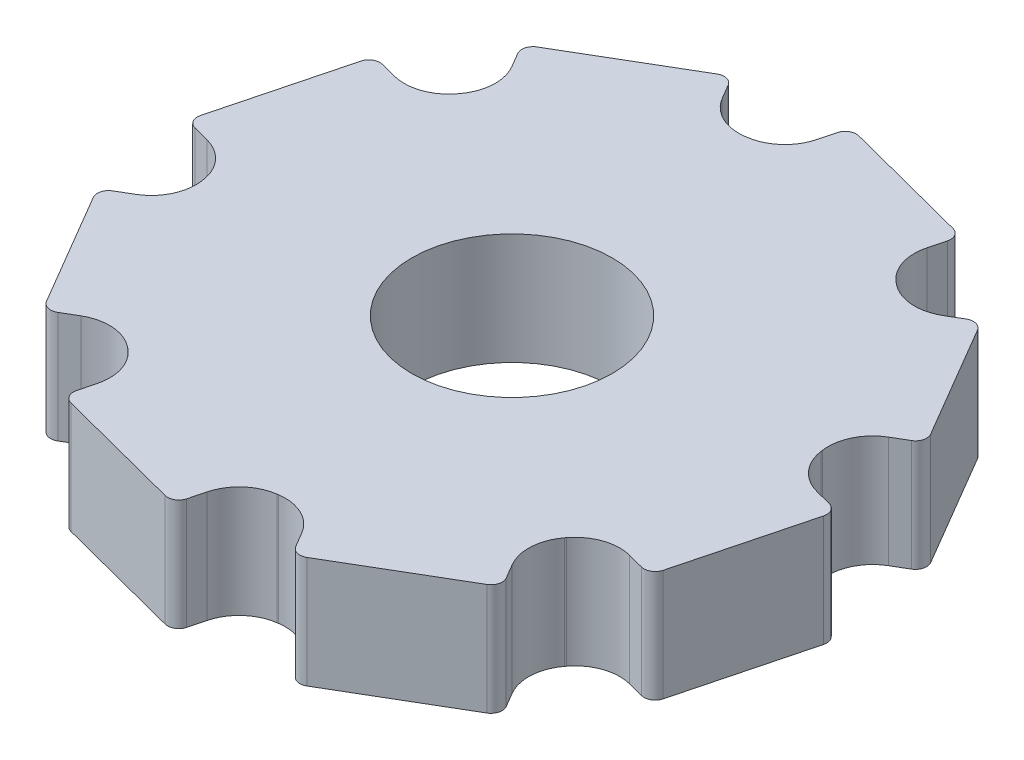
from build123d import *

# Parameters (mm, degrees)
SKETCH_1_R      = 0.9
EXTRUDE_1_DEPTH = 1


with BuildPart() as part:
    # Эскиз1 → Бобышка-Вытянуть1 (new body)
    with BuildSketch(Plane(origin=(0, 0, 0), x_dir=(1, 0, 0), z_dir=(0, 1, 0))):
        with BuildLine():
            Line((-2.955209453, 0.158565738), (-2.658114772, 1.301088723))
            ThreePointArc((-2.658114772, 1.301088723), (-2.611972769, 1.36215246), (-2.536166863, 1.372703719))
            Line((-2.536166863, 1.372703719), (-2.390204654, 1.3347486))
            ThreePointArc((-2.390204654, 1.3347486), (-2.157733286, 1.344214113), (-1.969855467, 1.481452804))
            ThreePointArc((-1.969855467, 1.481452804), (-1.966473238, 1.485939425), (-1.96308079, 1.490418325))
            ThreePointArc((-1.96308079, 1.490418325), (-1.882365193, 1.708632727), (-1.936743933, 1.934852721))
            Line((-1.936743933, 1.934852721), (-2.013116479, 2.064901911))
            ThreePointArc((-2.013116479, 2.064901911), (-2.023667738, 2.140707816), (-1.977525735, 2.201771553))
            Line((-1.977525735, 2.201771553), (-0.959562321, 2.799579639))
            ThreePointArc((-0.959562321, 2.799579639), (-0.883756416, 2.810130898), (-0.822692679, 2.763988896))
            Line((-0.822692679, 2.763988896), (-0.746320133, 2.633939706))
            ThreePointArc((-0.746320133, 2.633939706), (-0.575244924, 2.476250753), (-0.345352836, 2.440443482))
            ThreePointArc((-0.345352836, 2.440443482), (-0.339788718, 2.441224406), (-0.334222834, 2.441992643))
            ThreePointArc((-0.334222834, 2.441992643), (-0.122847405, 2.539218981), (-0.001337289, 2.737632248))
            Line((-0.001337289, 2.737632248), (0.03661783, 2.883594457))
            ThreePointArc((0.03661783, 2.883594457), (0.082759833, 2.944658194), (0.158565738, 2.955209453))
            Line((0.158565738, 2.955209453), (1.301088723, 2.658114772))
            ThreePointArc((1.301088723, 2.658114772), (1.36215246, 2.611972769), (1.372703719, 2.536166863))
            Line((1.372703719, 2.536166863), (1.3347486, 2.390204654))
            ThreePointArc((1.3347486, 2.390204654), (1.344214113, 2.157733286), (1.481452804, 1.969855467))
            ThreePointArc((1.481452804, 1.969855467), (1.485939425, 1.966473238), (1.490418325, 1.96308079))
            ThreePointArc((1.490418325, 1.96308079), (1.708632727, 1.882365193), (1.934852721, 1.936743933))
            Line((1.934852721, 1.936743933), (2.064901911, 2.013116479))
            ThreePointArc((2.064901911, 2.013116479), (2.140707816, 2.023667738), (2.201771553, 1.977525735))
            Line((2.201771553, 1.977525735), (2.799579639, 0.959562321))
            ThreePointArc((2.799579639, 0.959562321), (2.810130898, 0.883756416), (2.763988896, 0.822692679))
            Line((2.763988896, 0.822692679), (2.633939706, 0.746320133))
            ThreePointArc((2.633939706, 0.746320133), (2.476250753, 0.575244924), (2.440443482, 0.345352836))
            ThreePointArc((2.440443482, 0.345352836), (2.441224406, 0.339788718), (2.441992643, 0.334222834))
            ThreePointArc((2.441992643, 0.334222834), (2.539218981, 0.122847405), (2.737632248, 0.001337289))
            Line((2.737632248, 0.001337289), (2.883594457, -0.03661783))
            ThreePointArc((2.883594457, -0.03661783), (2.944658194, -0.082759833), (2.955209453, -0.158565738))
            Line((2.955209453, -0.158565738), (2.658114772, -1.301088723))
            ThreePointArc((2.658114772, -1.301088723), (2.611972769, -1.36215246), (2.536166863, -1.372703719))
            Line((2.536166863, -1.372703719), (2.390204654, -1.3347486))
            ThreePointArc((2.390204654, -1.3347486), (2.157733286, -1.344214113), (1.969855467, -1.481452804))
            ThreePointArc((1.969855467, -1.481452804), (1.966473238, -1.485939425), (1.96308079, -1.490418325))
            ThreePointArc((1.96308079, -1.490418325), (1.882365193, -1.708632727), (1.936743933, -1.934852721))
            Line((1.936743933, -1.934852721), (2.013116479, -2.064901911))
            ThreePointArc((2.013116479, -2.064901911), (2.023667738, -2.140707816), (1.977525735, -2.201771553))
            Line((1.977525735, -2.201771553), (0.959562321, -2.799579639))
            ThreePointArc((0.959562321, -2.799579639), (0.883756416, -2.810130898), (0.822692679, -2.763988896))
            Line((0.822692679, -2.763988896), (0.746320133, -2.633939706))
            ThreePointArc((0.746320133, -2.633939706), (0.575244924, -2.476250753), (0.345352836, -2.440443482))
            ThreePointArc((0.345352836, -2.440443482), (0.339788718, -2.441224406), (0.334222834, -2.441992643))
            ThreePointArc((0.334222834, -2.441992643), (0.122847405, -2.539218981), (0.001337289, -2.737632248))
            Line((0.001337289, -2.737632248), (-0.03661783, -2.883594457))
            ThreePointArc((-0.03661783, -2.883594457), (-0.082759833, -2.944658194), (-0.158565738, -2.955209453))
            Line((-0.158565738, -2.955209453), (-1.301088723, -2.658114772))
            ThreePointArc((-1.301088723, -2.658114772), (-1.36215246, -2.611972769), (-1.372703719, -2.536166863))
            Line((-1.372703719, -2.536166863), (-1.3347486, -2.390204654))
            ThreePointArc((-1.3347486, -2.390204654), (-1.344214113, -2.157733286), (-1.481452804, -1.969855467))
            ThreePointArc((-1.481452804, -1.969855467), (-1.485939425, -1.966473238), (-1.490418325, -1.96308079))
            ThreePointArc((-1.490418325, -1.96308079), (-1.708632727, -1.882365193), (-1.934852721, -1.936743933))
            Line((-1.934852721, -1.936743933), (-2.064901911, -2.013116479))
            ThreePointArc((-2.064901911, -2.013116479), (-2.140707816, -2.023667738), (-2.201771553, -1.977525735))
            Line((-2.201771553, -1.977525735), (-2.799579639, -0.959562321))
            ThreePointArc((-2.799579639, -0.959562321), (-2.810130898, -0.883756416), (-2.763988896, -0.822692679))
            Line((-2.763988896, -0.822692679), (-2.633939706, -0.746320133))
            ThreePointArc((-2.633939706, -0.746320133), (-2.476250753, -0.575244924), (-2.440443482, -0.345352836))
            ThreePointArc((-2.440443482, -0.345352836), (-2.441224406, -0.339788718), (-2.441992643, -0.334222834))
            ThreePointArc((-2.441992643, -0.334222834), (-2.539218981, -0.122847405), (-2.737632248, -0.001337289))
            Line((-2.737632248, -0.001337289), (-2.883594457, 0.03661783))
            ThreePointArc((-2.883594457, 0.03661783), (-2.944658194, 0.082759833), (-2.955209453, 0.158565738))
        make_face()
        with Locations(Location((0, 0, 0), (0, 0, 270))):
            Circle(SKETCH_1_R, mode=Mode.SUBTRACT)
    extrude(amount=EXTRUDE_1_DEPTH)


solid = part.part
